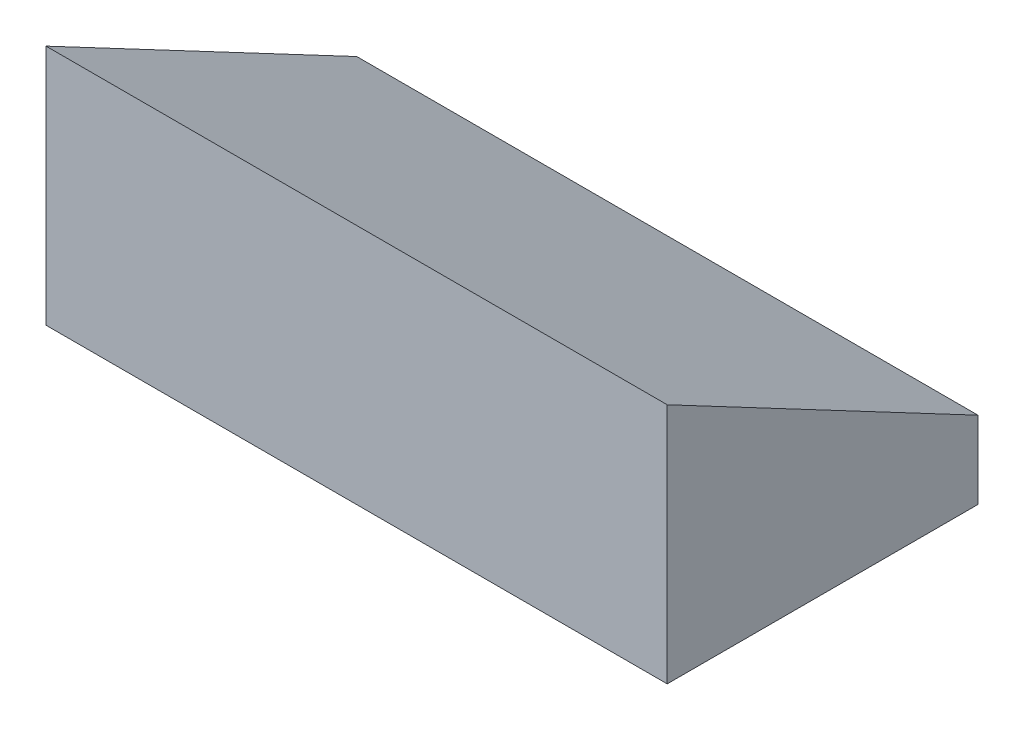
from build123d import *

# Parameters (mm, degrees)
BOSS_EXTRUDE1_DEPTH = 15.83
SHELL1_T            = -1.5
BOSS_EXTRUDE3_REACH = 20.742
SKETCH2_R           = 1.5
SKETCH2_R_2         = 0.67


with BuildPart() as part:
    # Sketch1 → Boss-Extrude1 (new body)
    with BuildSketch(Plane(origin=(0, 0, 0), x_dir=(0, 0, -1), z_dir=(1, 0, 0))):
        Polygon((0, 0), (0, 6.16), (7.92, 1.97), (7.92, 0), align=None)
    extrude(amount=BOSS_EXTRUDE1_DEPTH)

    # Shell1
    shell1_openings = [part.faces().sort_by_distance(p)[0] for p in [
        (7.915, 0, -3.96),
    ]]
    offset(amount=SHELL1_T, openings=shell1_openings, kind=Kind.INTERSECTION)

    # Boss-Extrude3: up to this plane
    boss_extrude3_end = Plane(origin=(15.83, 0.644114575, -7.218553039), z_dir=(0, -0.8839236168124106, 0.46763130737929287))
    # Sketch2 → Boss-Extrude3 (add, up to the surface)
    with BuildSketch(Plane(origin=(0, 0, 0), x_dir=(1, 0, 0), z_dir=(0, 1, 0)), mode=Mode.PRIVATE) as boss_extrude3_sk1:
        with Locations(Location((7.915, 3.96, 0), (0, 0, 90))):
            Circle(SKETCH2_R)
        with Locations(Location((7.915, 3.96, 0), (0, 0, 90))):
            Circle(SKETCH2_R_2, mode=Mode.SUBTRACT)
    boss_extrude3_tool1 = split(extrude(boss_extrude3_sk1.sketch, amount=BOSS_EXTRUDE3_REACH, mode=Mode.PRIVATE), bisect_by=boss_extrude3_end, keep=Keep.BOTH, mode=Mode.PRIVATE)
    add(boss_extrude3_tool1.solids().sort_by_distance((7.915, 0, -2.502426))[0])


solid = part.part
